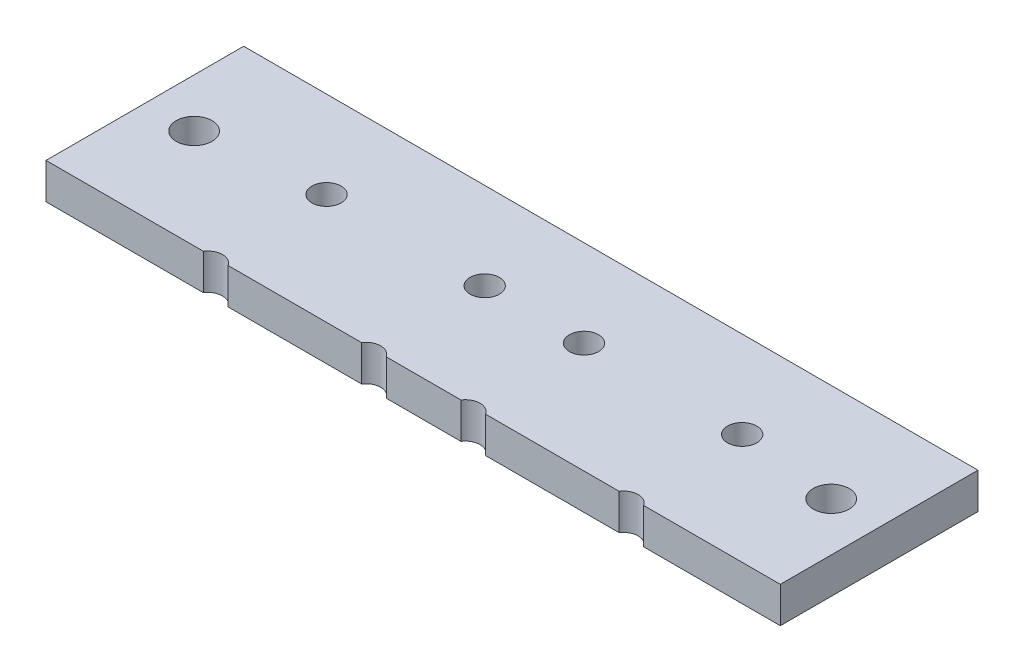
from build123d import *

# Parameters (mm, degrees)
SKETCH1_W           = 130
SKETCH1_H           = 35
BOSS_EXTRUDE1_DEPTH = 6.35
SKETCH5_R           = 3.18
CUT_EXTRUDE2_DEPTH  = 135.778790987
SKETCH8_R           = 2.58660254
CUT_EXTRUDE4_DEPTH  = 135.778790987


with BuildPart() as part:
    # Sketch1 → Boss-Extrude1 (new body)
    with BuildSketch(Plane(origin=(0, 0, 0), x_dir=(1, 0, 0), z_dir=(0, 1, 0))):
        with Locations((65, -17.5)):
            Rectangle(SKETCH1_W, SKETCH1_H)
    extrude(amount=BOSS_EXTRUDE1_DEPTH)

    # Sketch5 → Cut-Extrude2 (cut, through all)
    with BuildSketch(Plane(origin=(0, 6.35, 0), x_dir=(1, 0, 0), z_dir=(0, 1, 0))):
        with Locations(Location((8.605, -17.382603272, 0), (0, 0, 270))):
            Circle(SKETCH5_R)
        with Locations(Location((121.395, -17.382603272, 0), (0, 0, 270))):
            Circle(SKETCH5_R)
    extrude(amount=-CUT_EXTRUDE2_DEPTH, mode=Mode.SUBTRACT)

    # Sketch8 → Cut-Extrude4 (cut, through all)
    with BuildSketch(Plane.XZ):
        with Locations(Location((30.060178317, 15.396500763, 0), (0, 0, 270))):
            Circle(SKETCH8_R)
        with Locations((30.060178317, 36.396500763)):
            Circle(SKETCH8_R)
        with Locations((58.060178317, 36.396500763)):
            Circle(SKETCH8_R)
        with Locations(Location((58.060178317, 15.396500763, 0), (0, 0, 270))):
            Circle(SKETCH8_R)
        with Locations(Location((75.642130445, 15.396500763, 0), (0, 0, 270))):
            Circle(SKETCH8_R)
        with Locations((75.642130445, 36.396500763)):
            Circle(SKETCH8_R)
        with Locations(Location((103.642130445, 15.396500763, 0), (0, 0, 270))):
            Circle(SKETCH8_R)
        with Locations((103.642130445, 36.396500763)):
            Circle(SKETCH8_R)
    extrude(amount=-CUT_EXTRUDE4_DEPTH, mode=Mode.SUBTRACT)


solid = part.part
